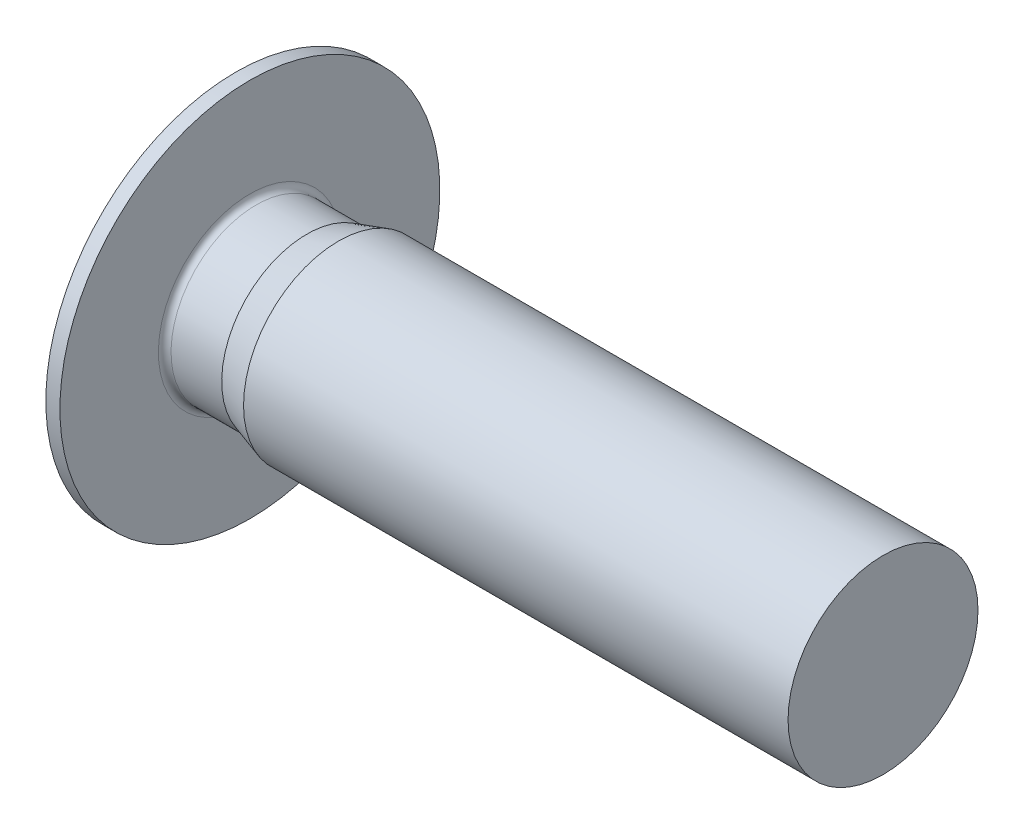
from build123d import *

# Parameters (mm, degrees)
FILLET1_R          = 0.1
CUT_EXTRUDE1_DEPTH = 2


with BuildPart() as part:
    # Sketch1 → Revolve1 (revolve)
    with BuildSketch(Plane.XY):
        Polygon((-0.8, 0), (-0.8, 2), (-0.222649731, 3), (0, 3), (0, 1.345), (0.9, 1.345), (1.4, 1.5), (10, 1.5), (10, 0), align=None)
    revolve(axis=Axis((-0.8, 0, 0), (1, 0, 0)))

    # Fillet1
    fillet1_edges = [part.edges().sort_by_distance(p)[0] for p in [
        (0, -1.345, 0),
    ]]
    fillet(fillet1_edges, radius=FILLET1_R)

    # Sketch2 → Cut-Extrude1 (cut)
    with BuildSketch(Plane.ZY.offset(0.8)):
        Polygon((0, 0.866025404), (-0.75, 0.433012702), (-0.75, -0.433012702), (0, -0.866025404), (0.75, -0.433012702), (0.75, 0.433012702), align=None)
    extrude(amount=-CUT_EXTRUDE1_DEPTH, mode=Mode.SUBTRACT)

    # Sketch3 → Cut-Revolve1 (revolve, cut)
    with BuildSketch(Plane.XY):
        Polygon((1.2, 0), (1.2, 0.75), (1.650645464, 0), align=None)
    revolve(axis=Axis((1.2, 0, 0), (1, 0, 0)), mode=Mode.SUBTRACT)


solid = part.part
